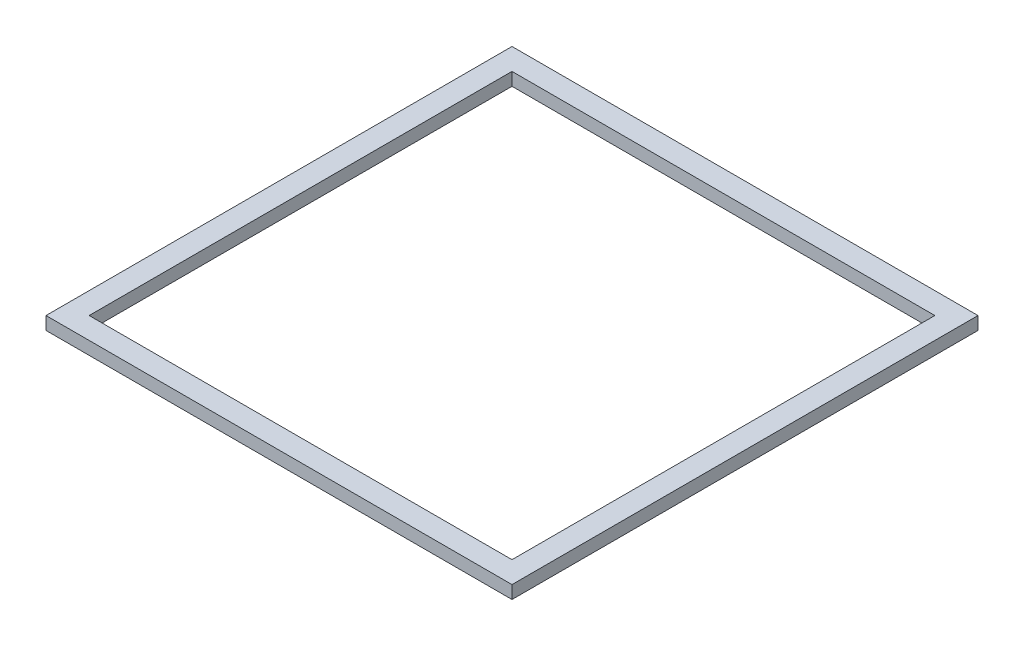
from build123d import *

# Parameters (mm, degrees)
SKETCH_1_W      = 108
SKETCH_1_H      = 108
SKETCH_1_W_2    = 98
SKETCH_1_H_2    = 98
EXTRUDE_1_DEPTH = 3


with BuildPart() as part:
    # 스케치1 → 보스-돌출1 (new body)
    with BuildSketch(Plane(origin=(0, 0, 0), x_dir=(1, 0, 0), z_dir=(0, 1, 0))):
        Rectangle(SKETCH_1_W, SKETCH_1_H)
        Rectangle(SKETCH_1_W_2, SKETCH_1_H_2, mode=Mode.SUBTRACT)
    extrude(amount=EXTRUDE_1_DEPTH)


solid = part.part
